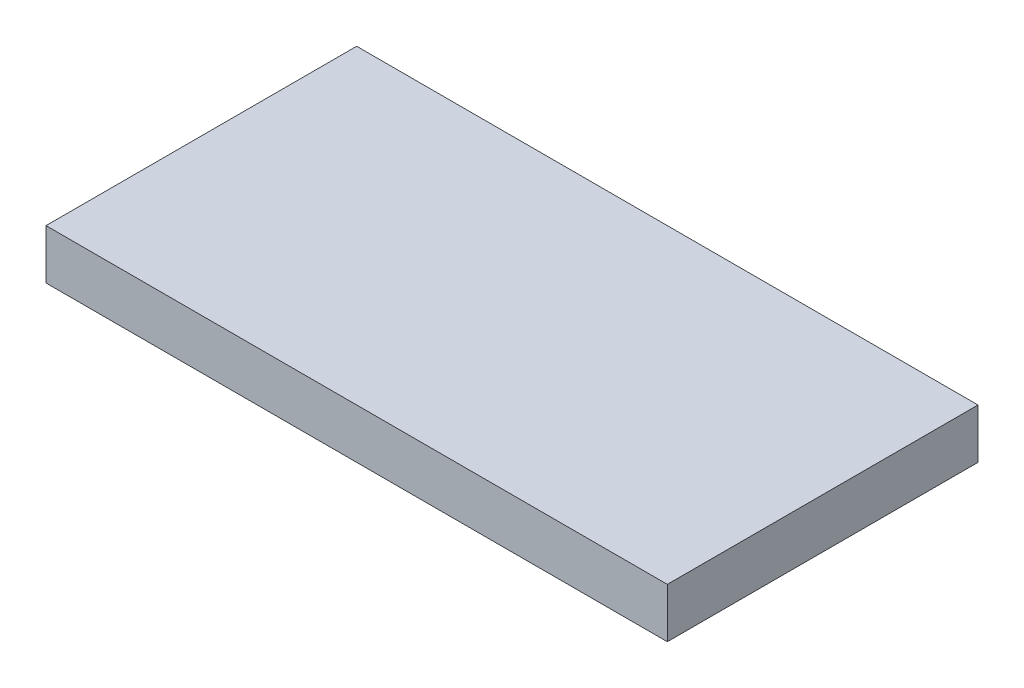
from build123d import *

# Parameters (mm, degrees)
SKETCH1_W           = 20
SKETCH1_H           = 10
BOSS_EXTRUDE1_DEPTH = 1.6


with BuildPart() as part:
    # Sketch1 → Boss-Extrude1 (new body)
    with BuildSketch(Plane(origin=(0, 0, 0), x_dir=(1, 0, 0), z_dir=(0, 1, 0))):
        with Locations((10, 5)):
            Rectangle(SKETCH1_W, SKETCH1_H)
    extrude(amount=BOSS_EXTRUDE1_DEPTH)


solid = part.part
